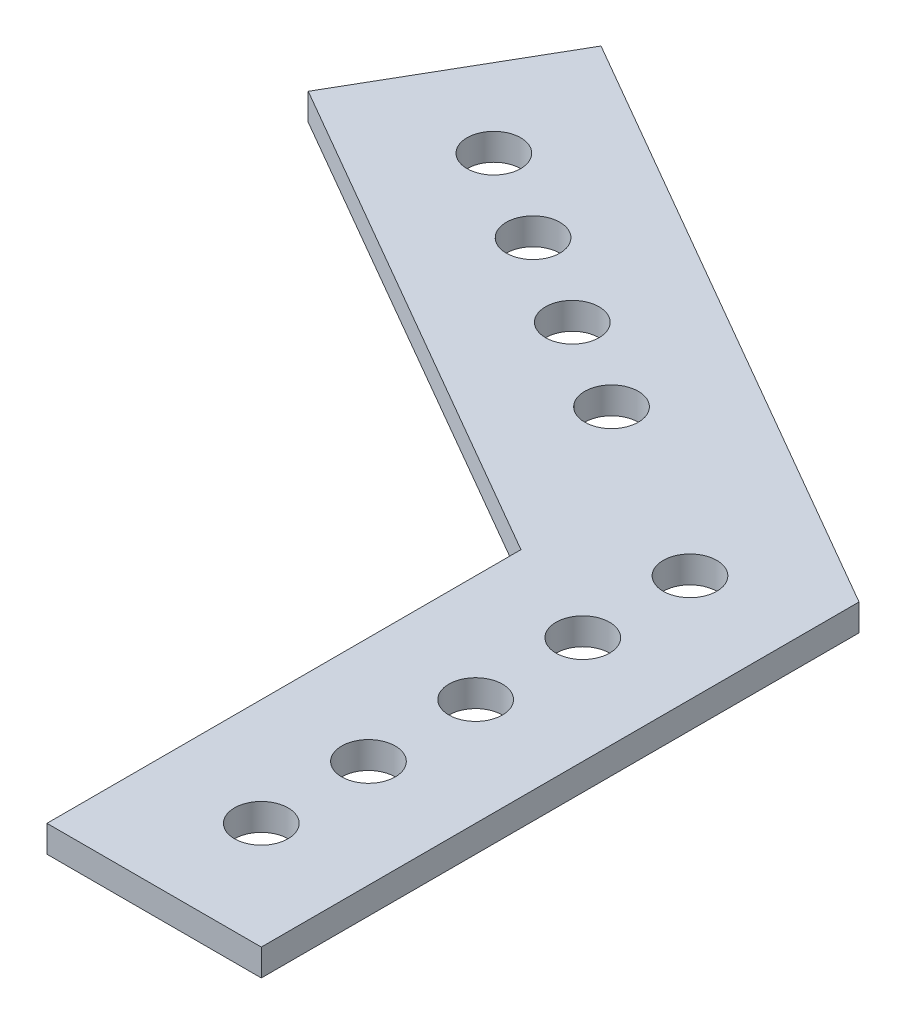
from build123d import *

# Parameters (mm, degrees)
BOSS_EXTRUDE1_DEPTH = 3.175
SKETCH2_R           = 3.175
CUT_EXTRUDE1_DEPTH  = 97.30976352


with BuildPart() as part:
    # Sketch1 → Boss-Extrude1 (new body)
    with BuildSketch(Plane(origin=(0, 0, 0), x_dir=(1, 0, 0), z_dir=(0, 1, 0))):
        Polygon((12.7, 7.332348419), (12.7, -63.5), (-12.7, -63.5), (-12.7, -7.332348419), (-72.341135768, 27.101477372), (-59.641135768, 49.098522628), align=None)
    extrude(amount=BOSS_EXTRUDE1_DEPTH)

    # Sketch2 → Cut-Extrude1 (cut, through all)
    with BuildSketch(Plane(origin=(0, 3.175, 0), x_dir=(1, 0, 0), z_dir=(0, 1, 0))):
        with Locations(Location((-54.99261314, 31.75, 0), (0, 0, 270))):
            Circle(SKETCH2_R)
        with Locations(Location((-43.994090512, 25.4, 0), (0, 0, 270))):
            Circle(SKETCH2_R)
        with Locations(Location((-32.995567884, 19.05, 0), (0, 0, 270))):
            Circle(SKETCH2_R)
        with Locations(Location((-21.997045256, 12.7, 0), (0, 0, 270))):
            Circle(SKETCH2_R)
        with Locations(Location((0, 0, 0), (0, 0, 270))):
            Circle(SKETCH2_R)
        with Locations(Location((0, -50.8, 0), (0, 0, 270))):
            Circle(SKETCH2_R)
        with Locations(Location((0, -38.1, 0), (0, 0, 270))):
            Circle(SKETCH2_R)
        with Locations(Location((0, -25.4, 0), (0, 0, 270))):
            Circle(SKETCH2_R)
        with Locations(Location((0, -12.7, 0), (0, 0, 270))):
            Circle(SKETCH2_R)
    extrude(amount=-CUT_EXTRUDE1_DEPTH, mode=Mode.SUBTRACT)


solid = part.part
